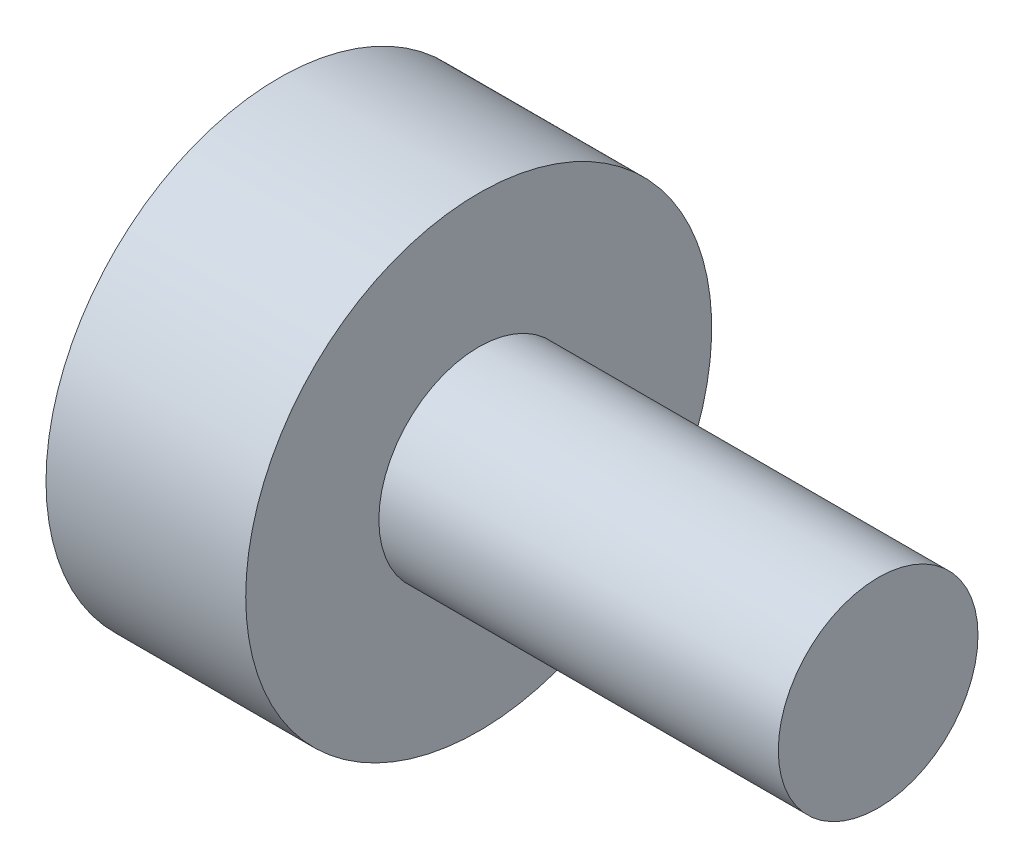
from build123d import *


with BuildPart() as part:
    # Эскиз1 → Повернуть1 (revolve)
    with BuildSketch(Plane.XY, mode=Mode.PRIVATE) as revolve_1_sk:
        Polygon((0, 0), (100, 0), (100, 15), (40, 15), (40, 35), (10, 35), (10, 20), (0, 20), align=None)
    revolve(revolve_1_sk.sketch.rotate(Axis((0, 0, 0), (1, 0, 0)), 90), axis=Axis((0, 0, 0), (1, 0, 0)))


solid = part.part
